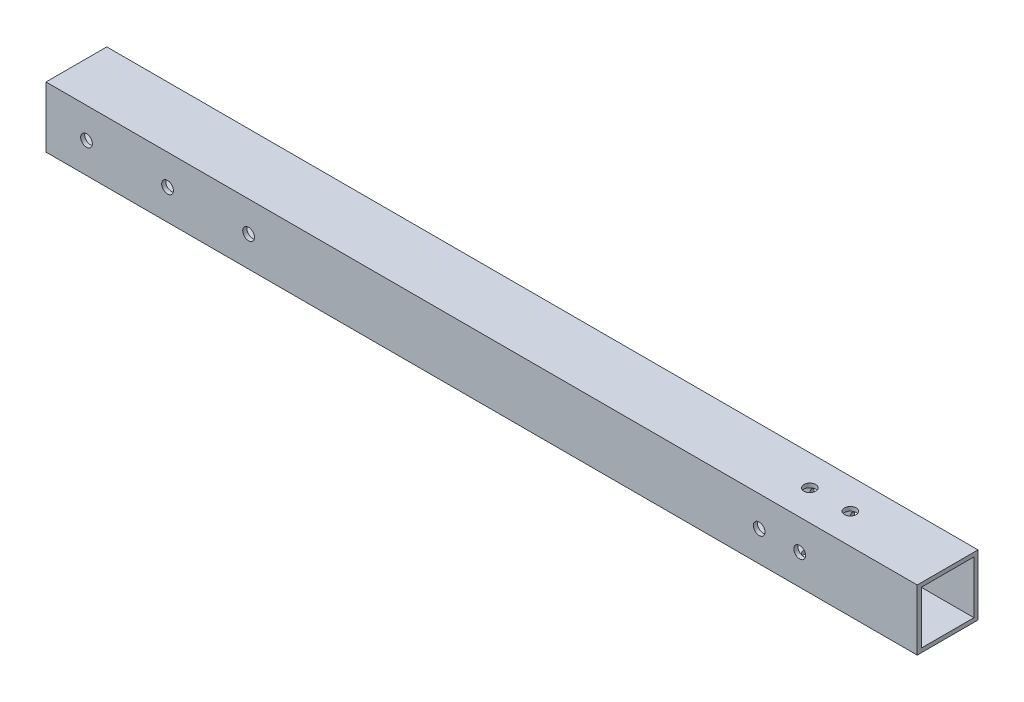
from build123d import *

# Parameters (mm, degrees)
SKETCH_1_W          = 15
SKETCH_1_H          = 15
SKETCH_1_W_2        = 13
SKETCH_1_H_2        = 13
EXTRUDE_1_DEPTH     = 215
SKETCH_2_R          = 1.45
CUT_EXTRUDE_1_DEPTH = 216.653077882
SKETCH_3_R          = 1.45
CUT_EXTRUDE_2_DEPTH = 216.653077882


with BuildPart() as part:
    # 草图1 → 凸台-拉伸1 (new body)
    with BuildSketch(Plane(origin=(0, 0, 0), x_dir=(0, 0, -1), z_dir=(1, 0, 0))):
        Rectangle(SKETCH_1_W, SKETCH_1_H)
        Rectangle(SKETCH_1_W_2, SKETCH_1_H_2, mode=Mode.SUBTRACT)
    extrude(amount=EXTRUDE_1_DEPTH)

    # 草图2 → 切除-拉伸1 (cut, through all)
    with BuildSketch(Plane.XY.offset(7.5)):
        with Locations((50, 0)):
            Circle(SKETCH_2_R)
        with Locations((30, 0)):
            Circle(SKETCH_2_R)
        with Locations((10, 0)):
            Circle(SKETCH_2_R)
        with Locations((186, 0)):
            Circle(SKETCH_2_R)
        with Locations((176, 0)):
            Circle(SKETCH_2_R)
    extrude(amount=-CUT_EXTRUDE_1_DEPTH, mode=Mode.SUBTRACT)

    # 草图3 → 切除-拉伸2 (cut, through all)
    with BuildSketch(Plane(origin=(0, 7.5, 0), x_dir=(1, 0, 0), z_dir=(0, 1, 0))):
        with Locations(Location((191, 0, 0), (0, 0, 270))):
            Circle(SKETCH_3_R)
        with Locations(Location((181, 0, 0), (0, 0, 270))):
            Circle(SKETCH_3_R)
    extrude(amount=-CUT_EXTRUDE_2_DEPTH, mode=Mode.SUBTRACT)


solid = part.part
